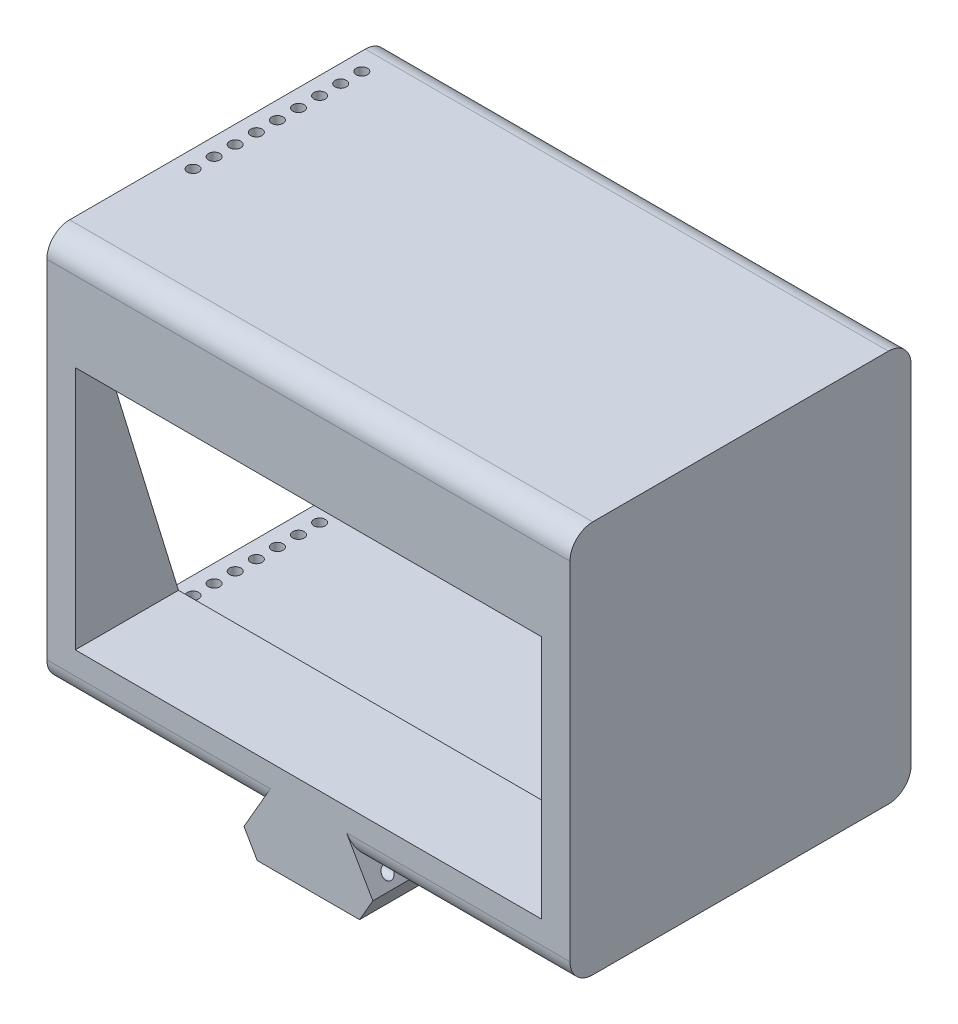
from build123d import *

# Parameters (mm, degrees)
BASE_DEPTH               = 46
BASE_DEPTH_BACK          = 46
SKETCH4_W                = 60
SKETCH4_H                = 69
LIDAR_DEPTH              = 41
LIDAR_DEPTH_BACK         = 46
HOLEFRONTBACK_DEPTH      = 66.941261741
HOLEFRONTBACK_DEPTH_BACK = 66.941261741
SKETCH6_W                = 82
SKETCH6_H                = 43
RAIL_START               = -30
RAIL_DEPTH               = 60
SKETCH8_R                = 1
RAILHOLE_DEPTH           = 71.740017959
LPATTERN1_COUNT          = 15
LPATTERN1_PITCH          = 3.71
FILLET2_R                = 4
SAFETY_REACH             = 72.74
SKETCH9_R                = 1
SAFETY_DIRECTION_2_DEPTH = 34.6
LPATTERN2_COUNT          = 9
LPATTERN2_PITCH          = 3.71


with BuildPart() as part:
    # Sketch4 → Base (new, two sides: drawn at the far end of the back side and taken through both)
    with BuildSketch(Plane(origin=(0, 0, 0), x_dir=(0, 0, -1), z_dir=(1, 0, 0)).offset(-BASE_DEPTH_BACK)):
        with Locations((0, -2)):
            Rectangle(SKETCH4_W, SKETCH4_H)
    extrude(amount=BASE_DEPTH + BASE_DEPTH_BACK)

    # Sketch5 → LIDAR (cut, two sides: drawn at the far end of the back side and taken through both)
    with BuildSketch(Plane(origin=(0, 0, 0), x_dir=(0, 0, -1), z_dir=(1, 0, 0)).offset(-LIDAR_DEPTH_BACK)):
        Polygon((-25, 27.5), (-25, 14.5), (-10.630657971, -32.5), (25, -32.5), (25, 27.5), align=None)
    extrude(amount=LIDAR_DEPTH + LIDAR_DEPTH_BACK, mode=Mode.SUBTRACT)

    # Sketch6 → HoleFrontBack (cut, two sides: drawn at the far end of the back side and taken through both)
    with BuildSketch(Plane.XY.offset(-HOLEFRONTBACK_DEPTH_BACK)):
        with Locations((0, -7)):
            Rectangle(SKETCH6_W, SKETCH6_H)
    extrude(amount=HOLEFRONTBACK_DEPTH + HOLEFRONTBACK_DEPTH_BACK, mode=Mode.SUBTRACT)

    # Sketch7 → Rail (add)
    with BuildSketch(Plane.XY.offset(RAIL_START)):
        Polygon((-9, -36.5), (9, -36.5), (11.335, -40.544338636), (9, -44.588677271), (-9, -44.588677271), (-11.335, -40.544338636), align=None)
    extrude(amount=RAIL_DEPTH)

    # Sketch8 → RailHole (cut, symmetric)
    with BuildSketch(Plane(origin=(0, 0, 0), x_dir=(0, 0, -1), z_dir=(1, 0, 0))):
        with Locations(Location((-26.29, -38.6, 0), (0, 0, 270))):
            Circle(SKETCH8_R)
    railhole = extrude(amount=RAILHOLE_DEPTH, both=True, mode=Mode.SUBTRACT)

    # LPattern1: RailHole ×15
    with Locations(*[(0, 0, -i * LPATTERN1_PITCH) for i in range(1, LPATTERN1_COUNT)]):
        add(railhole, mode=Mode.SUBTRACT)

    # Fillet2
    fillet2_edges = [part.edges().sort_by_distance(p)[0] for p in [
        (27.5, -36.5, -30),
        (27.5, -36.5, 30),
        (0, 32.5, 30),
        (0, 32.5, -30),
        (-27.5, -36.5, -30),
        (-27.5, -36.5, 30),
    ]]
    fillet(fillet2_edges, radius=FILLET2_R)

    # Safety: up to this face of the body (flat: up to its plane)
    safety_end = Plane(part.part.faces().sort_by_distance((0, 32.5, 0))[0])
    # Sketch9 → Safety (cut, up to the picked face)
    with BuildSketch(Plane(origin=(0, 0, 0), x_dir=(1, 0, 0), z_dir=(0, 1, 0)), mode=Mode.PRIVATE) as safety_sk1:
        with Locations(Location((-42.9, 22.29, 0), (0, 0, 270))):
            Circle(SKETCH9_R)
    safety_tool1 = split(extrude(safety_sk1.sketch, amount=SAFETY_REACH, mode=Mode.PRIVATE), bisect_by=safety_end, keep=Keep.BOTH, mode=Mode.PRIVATE)
    safety = safety_tool1.solids().sort_by(Axis((-42.9, 0, -22.29), (0, 1, 0)))[0]
    add(safety, mode=Mode.SUBTRACT)

    # Sketch9 → Safety direction 2 (cut)
    with BuildSketch(Plane(origin=(0, 0, 0), x_dir=(1, 0, 0), z_dir=(0, 1, 0))):
        with Locations(Location((-42.9, 22.29, 0), (0, 0, 270))):
            Circle(SKETCH9_R)
    safety_direction_2 = extrude(amount=-SAFETY_DIRECTION_2_DEPTH, mode=Mode.SUBTRACT)

    # LPattern2: Safety, Safety direction 2 ×9
    with Locations(*[(0, 0, i * LPATTERN2_PITCH) for i in range(1, LPATTERN2_COUNT)]):
        add(safety, mode=Mode.SUBTRACT)
        add(safety_direction_2, mode=Mode.SUBTRACT)


solid = part.part
